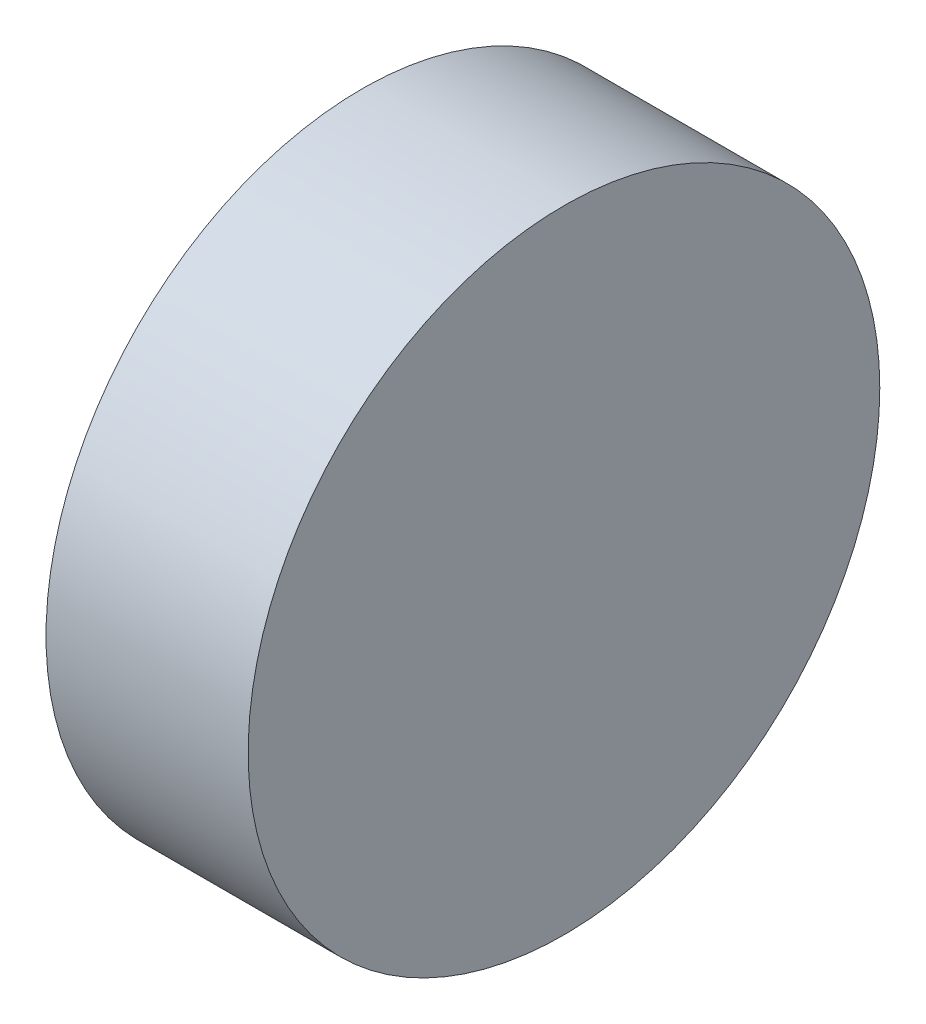
from build123d import *

# Parameters (mm, degrees)
SKETCH1_R           = 317.5
BOSS_EXTRUDE1_DEPTH = 203.2


with BuildPart() as part:
    # Sketch1 → Boss-Extrude1 (new body)
    with BuildSketch(Plane(origin=(0, 0, 0), x_dir=(0, 0, -1), z_dir=(1, 0, 0))):
        Circle(SKETCH1_R)
    extrude(amount=BOSS_EXTRUDE1_DEPTH)


solid = part.part
